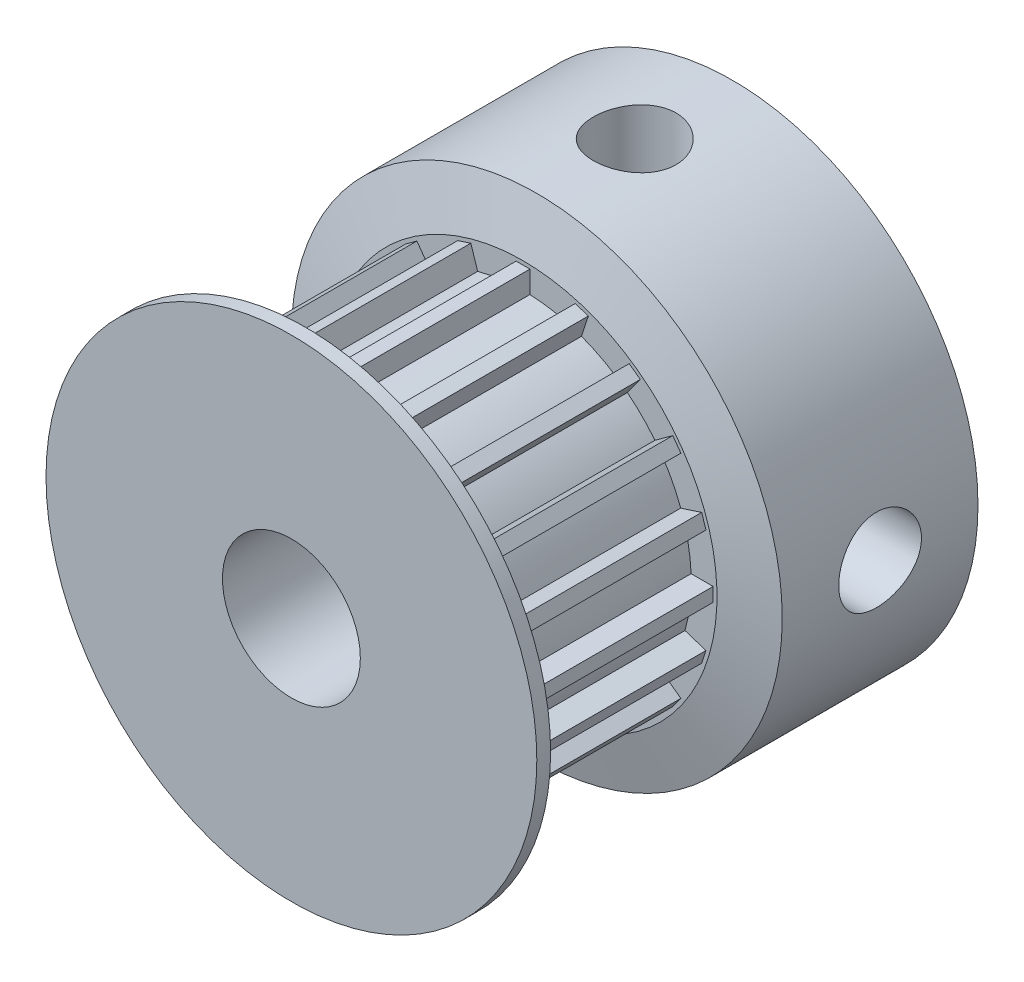
from build123d import *

# Parameters (mm, degrees)
CHAMFER1_SIZE       = 0.5
CHAMFER1_SIZE2      = 1.866025404
CHAMFER2_SIZE       = 0.5
CHAMFER2_SIZE2      = 1.866025404
BOSS_EXTRUDE1_START = 7.4
BOSS_EXTRUDE1_DEPTH = 7.4
SKETCH6_R           = 1.5
CUT_EXTRUDE1_DEPTH  = 10
CIRPATTERN1_COUNT   = 2
CIRPATTERN1_ANGLE   = 270


with BuildPart() as part:
    # Sketch2 → Revolve1 (revolve)
    with BuildSketch(Plane(origin=(0, 0, 0), x_dir=(0, 0, -1), z_dir=(1, 0, 0)), mode=Mode.PRIVATE) as revolve1_sk:
        Polygon((-16, 2.5), (0, 2.5), (0, 8.9), (-7.6, 8.9), (-7.6, 6.1), (-15, 6.1), (-15, 8.9), (-16, 8.9), align=None)
    revolve(revolve1_sk.sketch.rotate(Axis((0, 0, 79.609460318), (0, 0, -1)), 90), axis=Axis((0, 0, 79.609460318), (0, 0, -1)))

    # Chamfer1
    chamfer1_edges = [part.edges().sort_by_distance(p)[0] for p in [
        (-8.9, 0, 15),
    ]]
    chamfer1_side = [part.faces().sort_by_distance(p)[0] for p in [
        (-8.9, 0, 15.5),
    ]]
    chamfer(chamfer1_edges, length=CHAMFER1_SIZE, length2=CHAMFER1_SIZE2, reference=chamfer1_side[0])

    # Chamfer2
    chamfer2_edges = [part.edges().sort_by_distance(p)[0] for p in [
        (-8.9, 0, 7.6),
    ]]
    chamfer2_side = [part.faces().sort_by_distance(p)[0] for p in [
        (-8.9, 0, 3.8),
    ]]
    chamfer(chamfer2_edges, length=CHAMFER2_SIZE, length2=CHAMFER2_SIZE2, reference=chamfer2_side[0])

    # Sketch4 → Boss-Extrude1 (add)
    with BuildSketch(Plane.XY.offset(7.6).offset(BOSS_EXTRUDE1_START)):
        with BuildLine():
            Line((1.645655792, 5.873824735), (1.892869388, 6.634669948))
            Line((1.892869388, 6.634669948), (2.368397646, 6.48016145))
            Line((2.368397646, 6.48016145), (2.121184051, 5.719316237))
            ThreePointArc((2.121184051, 5.719316237), (1.885003666, 5.801444749), (1.645655792, 5.873824735))
        make_face()
        with BuildLine():
            Line((-0.25, 6.094874896), (-0.25, 6.894874896))
            Line((-0.25, 6.894874896), (0.25, 6.894874896))
            Line((0.25, 6.894874896), (0.25, 6.094874896))
            ThreePointArc((0.25, 6.094874896), (0, 6.1), (-0.25, 6.094874896))
        make_face()
        with BuildLine():
            Line((3.38022333, 5.077803683), (3.850451532, 5.725017278))
            Line((3.850451532, 5.725017278), (4.254960029, 5.431124652))
            Line((4.254960029, 5.431124652), (3.784731827, 4.783911057))
            ThreePointArc((3.784731827, 4.783911057), (3.585490039, 4.935003666), (3.38022333, 5.077803683))
        make_face()
        with BuildLine():
            Line((4.783911057, 3.784731827), (5.431124652, 4.254960029))
            Line((5.431124652, 4.254960029), (5.725017278, 3.850451532))
            Line((5.725017278, 3.850451532), (5.077803683, 3.38022333))
            ThreePointArc((5.077803683, 3.38022333), (4.935003666, 3.585490039), (4.783911057, 3.784731827))
        make_face()
        with BuildLine():
            Line((5.719316237, 2.121184051), (6.48016145, 2.368397646))
            Line((6.48016145, 2.368397646), (6.634669948, 1.892869388))
            Line((6.634669948, 1.892869388), (5.873824735, 1.645655792))
            ThreePointArc((5.873824735, 1.645655792), (5.801444749, 1.885003666), (5.719316237, 2.121184051))
        make_face()
        with BuildLine():
            Line((6.094874896, 0.25), (6.894874896, 0.25))
            Line((6.894874896, 0.25), (6.894874896, -0.25))
            Line((6.894874896, -0.25), (6.094874896, -0.25))
            ThreePointArc((6.094874896, -0.25), (6.1, 0), (6.094874896, 0.25))
        make_face()
        with BuildLine():
            Line((5.873824735, -1.645655792), (6.634669948, -1.892869388))
            Line((6.634669948, -1.892869388), (6.48016145, -2.368397646))
            Line((6.48016145, -2.368397646), (5.719316237, -2.121184051))
            ThreePointArc((5.719316237, -2.121184051), (5.801444749, -1.885003666), (5.873824735, -1.645655792))
        make_face()
        with BuildLine():
            Line((5.077803683, -3.38022333), (5.725017278, -3.850451532))
            Line((5.725017278, -3.850451532), (5.431124652, -4.254960029))
            Line((5.431124652, -4.254960029), (4.783911057, -3.784731827))
            ThreePointArc((4.783911057, -3.784731827), (4.935003666, -3.585490039), (5.077803683, -3.38022333))
        make_face()
        with BuildLine():
            Line((3.784731827, -4.783911057), (4.254960029, -5.431124652))
            Line((4.254960029, -5.431124652), (3.850451532, -5.725017278))
            Line((3.850451532, -5.725017278), (3.38022333, -5.077803683))
            ThreePointArc((3.38022333, -5.077803683), (3.585490039, -4.935003666), (3.784731827, -4.783911057))
        make_face()
        with BuildLine():
            Line((2.121184051, -5.719316237), (2.368397646, -6.48016145))
            Line((2.368397646, -6.48016145), (1.892869388, -6.634669948))
            Line((1.892869388, -6.634669948), (1.645655792, -5.873824735))
            ThreePointArc((1.645655792, -5.873824735), (1.885003666, -5.801444749), (2.121184051, -5.719316237))
        make_face()
        with BuildLine():
            Line((0.25, -6.094874896), (0.25, -6.894874896))
            Line((0.25, -6.894874896), (-0.25, -6.894874896))
            Line((-0.25, -6.894874896), (-0.25, -6.094874896))
            ThreePointArc((-0.25, -6.094874896), (0, -6.1), (0.25, -6.094874896))
        make_face()
        with BuildLine():
            Line((-1.645655792, -5.873824735), (-1.892869388, -6.634669948))
            Line((-1.892869388, -6.634669948), (-2.368397646, -6.48016145))
            Line((-2.368397646, -6.48016145), (-2.121184051, -5.719316237))
            ThreePointArc((-2.121184051, -5.719316237), (-1.885003666, -5.801444749), (-1.645655792, -5.873824735))
        make_face()
        with BuildLine():
            Line((-3.38022333, -5.077803683), (-3.850451532, -5.725017278))
            Line((-3.850451532, -5.725017278), (-4.254960029, -5.431124652))
            Line((-4.254960029, -5.431124652), (-3.784731827, -4.783911057))
            ThreePointArc((-3.784731827, -4.783911057), (-3.585490039, -4.935003666), (-3.38022333, -5.077803683))
        make_face()
        with BuildLine():
            Line((-4.783911057, -3.784731827), (-5.431124652, -4.254960029))
            Line((-5.431124652, -4.254960029), (-5.725017278, -3.850451532))
            Line((-5.725017278, -3.850451532), (-5.077803683, -3.38022333))
            ThreePointArc((-5.077803683, -3.38022333), (-4.935003666, -3.585490039), (-4.783911057, -3.784731827))
        make_face()
        with BuildLine():
            Line((-5.719316237, -2.121184051), (-6.48016145, -2.368397646))
            Line((-6.48016145, -2.368397646), (-6.634669948, -1.892869388))
            Line((-6.634669948, -1.892869388), (-5.873824735, -1.645655792))
            ThreePointArc((-5.873824735, -1.645655792), (-5.801444749, -1.885003666), (-5.719316237, -2.121184051))
        make_face()
        with BuildLine():
            Line((-6.094874896, -0.25), (-6.894874896, -0.25))
            Line((-6.894874896, -0.25), (-6.894874896, 0.25))
            Line((-6.894874896, 0.25), (-6.094874896, 0.25))
            ThreePointArc((-6.094874896, 0.25), (-6.1, 0), (-6.094874896, -0.25))
        make_face()
        with BuildLine():
            Line((-5.873824735, 1.645655792), (-6.634669948, 1.892869388))
            Line((-6.634669948, 1.892869388), (-6.48016145, 2.368397646))
            Line((-6.48016145, 2.368397646), (-5.719316237, 2.121184051))
            ThreePointArc((-5.719316237, 2.121184051), (-5.801444749, 1.885003666), (-5.873824735, 1.645655792))
        make_face()
        with BuildLine():
            Line((-5.077803683, 3.38022333), (-5.725017278, 3.850451532))
            Line((-5.725017278, 3.850451532), (-5.431124652, 4.254960029))
            Line((-5.431124652, 4.254960029), (-4.783911057, 3.784731827))
            ThreePointArc((-4.783911057, 3.784731827), (-4.935003666, 3.585490039), (-5.077803683, 3.38022333))
        make_face()
        with BuildLine():
            Line((-3.784731827, 4.783911057), (-4.254960029, 5.431124652))
            Line((-4.254960029, 5.431124652), (-3.850451532, 5.725017278))
            Line((-3.850451532, 5.725017278), (-3.38022333, 5.077803683))
            ThreePointArc((-3.38022333, 5.077803683), (-3.585490039, 4.935003666), (-3.784731827, 4.783911057))
        make_face()
        with BuildLine():
            Line((-2.121184051, 5.719316237), (-2.368397646, 6.48016145))
            Line((-2.368397646, 6.48016145), (-1.892869388, 6.634669948))
            Line((-1.892869388, 6.634669948), (-1.645655792, 5.873824735))
            ThreePointArc((-1.645655792, 5.873824735), (-1.885003666, 5.801444749), (-2.121184051, 5.719316237))
        make_face()
    extrude(amount=-BOSS_EXTRUDE1_DEPTH)

    # Sketch6 → Cut-Extrude1 (cut)
    with BuildSketch(Plane(origin=(0, 8.9, 0), x_dir=(-1, 0, 0), z_dir=(0, 1, 0))):
        with Locations(Location((0, 3.55, 0), (0, 0, 90))):
            Circle(SKETCH6_R)
    cut_extrude1 = extrude(amount=-CUT_EXTRUDE1_DEPTH, mode=Mode.SUBTRACT)

    # CirPattern1: Cut-Extrude1 ×2 about axis
    cirpattern1_axis = Axis((0, 0, 0), (0, 0, 1))
    for i in range(1, CIRPATTERN1_COUNT):
        add(cut_extrude1.rotate(cirpattern1_axis, i * CIRPATTERN1_ANGLE / (CIRPATTERN1_COUNT - 1)), mode=Mode.SUBTRACT)


solid = part.part
